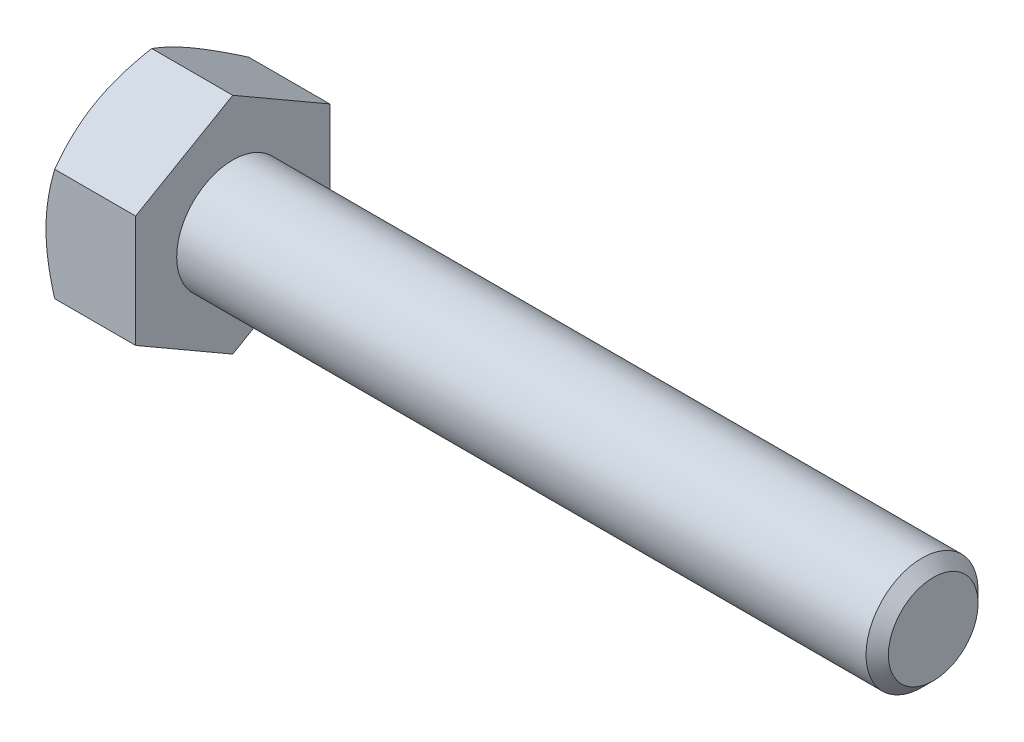
from build123d import *

# Parameters (mm, degrees)
BOSS_EXTRUDE2_DEPTH = 19.2
SKETCH1_5_R         = 12
BOSS_EXTRUDE3_DEPTH = 169.2
SKETCH2_OUTSIDE_W   = 146.226
SKETCH2_OUTSIDE_H   = 152.656
SKETCH2_OUTSIDE_R   = 20.784609691
CUT_EXTRUDE1_DEPTH  = 19.2
CUT_EXTRUDE1_DRAFT  = -60
CHAMFER1_SIZE       = 2.4


with BuildPart() as part:
    # Sketch1 → Boss-Extrude2 (new body)
    with BuildSketch(Plane(origin=(0, 0, 0), x_dir=(0, 0, -1), z_dir=(1, 0, 0))):
        Polygon((0, -24), (20.784609691, -12), (20.784609691, 12), (0, 24), (-20.784609691, 12), (-20.784609691, -12), align=None)
    extrude(amount=BOSS_EXTRUDE2_DEPTH)

    # Sketch1<5> → Boss-Extrude3 (add)
    with BuildSketch(Plane(origin=(0, 0, 0), x_dir=(0, 0, -1), z_dir=(1, 0, 0))):
        Circle(SKETCH1_5_R)
    extrude(amount=BOSS_EXTRUDE3_DEPTH)


with BuildPart() as cut_extrude1_tool:
    # Sketch2 outside → Cut-Extrude1 (with draft: the straight prism first)
    with BuildSketch(Plane.ZY):
        Rectangle(SKETCH2_OUTSIDE_W, SKETCH2_OUTSIDE_H)
        Circle(SKETCH2_OUTSIDE_R, mode=Mode.SUBTRACT)
    extrude(amount=-CUT_EXTRUDE1_DEPTH)
    # Cut-Extrude1: the draft: its side faces are tilted about the plane it starts from
    cut_extrude1_sides = [cut_extrude1_tool.faces().sort_by_distance(p)[0] for p in [
        (9.6, -76.328, 0),
        (9.6, 0, 73.113),
        (9.6, 76.328, 0),
        (9.6, 0, -73.113),
        (9.6, 0, -20.784609691),
    ]]
    draft(cut_extrude1_sides, Plane.ZY, CUT_EXTRUDE1_DRAFT)


with BuildPart() as part_1:
    add(part.part)

    # Cut-Extrude1: cut by cut_extrude1_tool
    add(cut_extrude1_tool.part, mode=Mode.SUBTRACT)

    # Chamfer1
    chamfer1_edges = [part_1.edges().sort_by_distance(p)[0] for p in [
        (169.2, 0, 12),
    ]]
    chamfer(chamfer1_edges, length=CHAMFER1_SIZE)


solid = part_1.part
